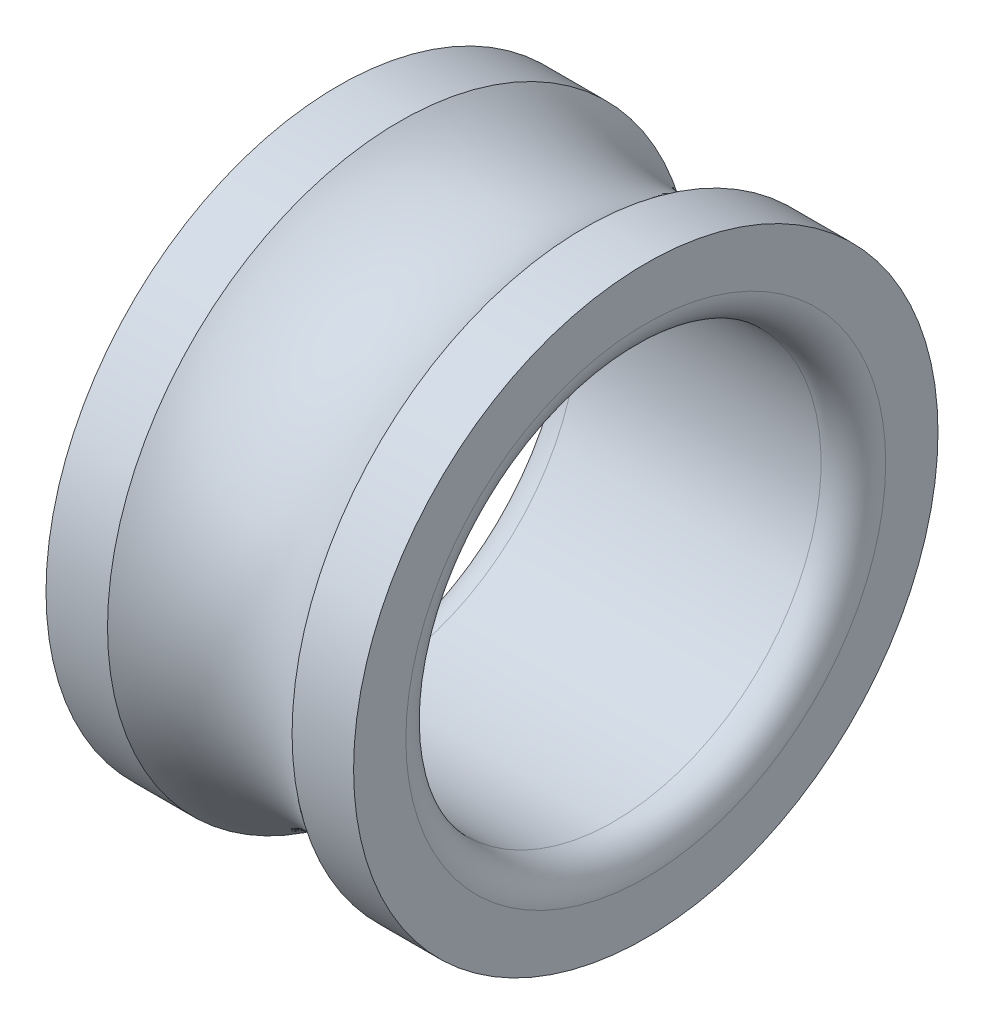
from build123d import *


with BuildPart() as part:
    # Sketch1 → Revolve1 (revolve)
    with BuildSketch(Plane.XY, mode=Mode.PRIVATE) as revolve1_sk:
        with BuildLine():
            Line((10, 19), (6, 19))
            ThreePointArc((6, 19), (0, 17), (-6, 19))
            Line((-6, 19), (-10, 19))
            Line((-10, 19), (-10, 15.6))
            ThreePointArc((-10, 15.6), (-9.38492424, 14.11507576), (-7.9, 13.5))
            Line((-7.9, 13.5), (7.9, 13.5))
            ThreePointArc((7.9, 13.5), (9.38492424, 14.11507576), (10, 15.6))
            Line((10, 15.6), (10, 19))
        make_face()
    revolve(revolve1_sk.sketch.rotate(Axis((-10, 0, 0), (1, 0, 0)), 90), axis=Axis((-10, 0, 0), (1, 0, 0)))


solid = part.part
